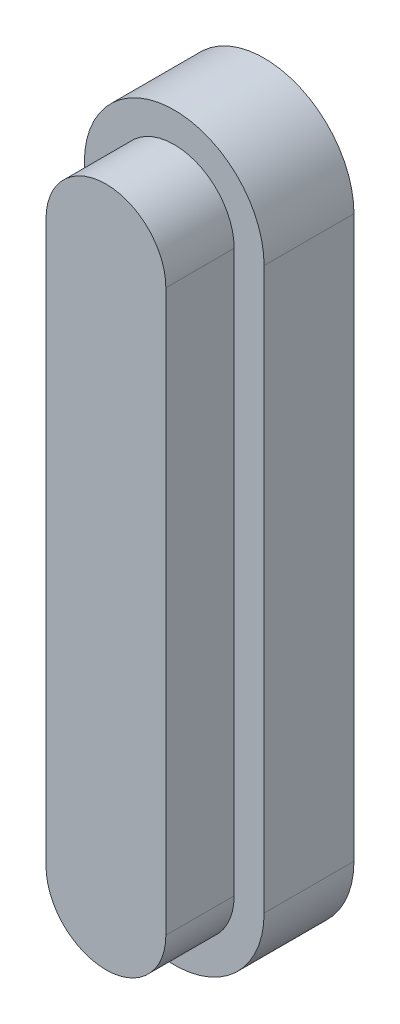
from build123d import *

# Parameters (mm, degrees)
BOSS_EXTRUDE1_DEPTH = 2.38125
BOSS_EXTRUDE2_DEPTH = 4.191


with BuildPart() as part:
    # Sketch1 → Boss-Extrude1 (new body)
    with BuildSketch(Plane.XY):
        with BuildLine():
            Line((2.38125, -14.859), (2.38125, 0))
            ThreePointArc((2.38125, 0), (0, 2.38125), (-2.38125, 0))
            Line((-2.38125, 0), (-2.38125, -14.859))
            ThreePointArc((-2.38125, -14.859), (0, -17.24025), (2.38125, -14.859))
        make_face()
        with BuildLine():
            Line((1.5875, -14.859), (1.5875, 0))
            ThreePointArc((1.5875, 0), (0, 1.5875), (-1.5875, 0))
            Line((-1.5875, 0), (-1.5875, -14.859))
            ThreePointArc((-1.5875, -14.859), (0, -16.4465), (1.5875, -14.859))
        make_face(mode=Mode.SUBTRACT)
    extrude(amount=BOSS_EXTRUDE1_DEPTH)

    # Sketch1<5> → Boss-Extrude2 (add)
    with BuildSketch(Plane.XY):
        with BuildLine():
            ThreePointArc((-1.5875, -14.859), (0, -16.4465), (1.5875, -14.859))
            Line((1.5875, -14.859), (1.5875, 0))
            ThreePointArc((1.5875, 0), (0, 1.5875), (-1.5875, 0))
            Line((-1.5875, 0), (-1.5875, -14.859))
        make_face()
    extrude(amount=BOSS_EXTRUDE2_DEPTH)


solid = part.part
